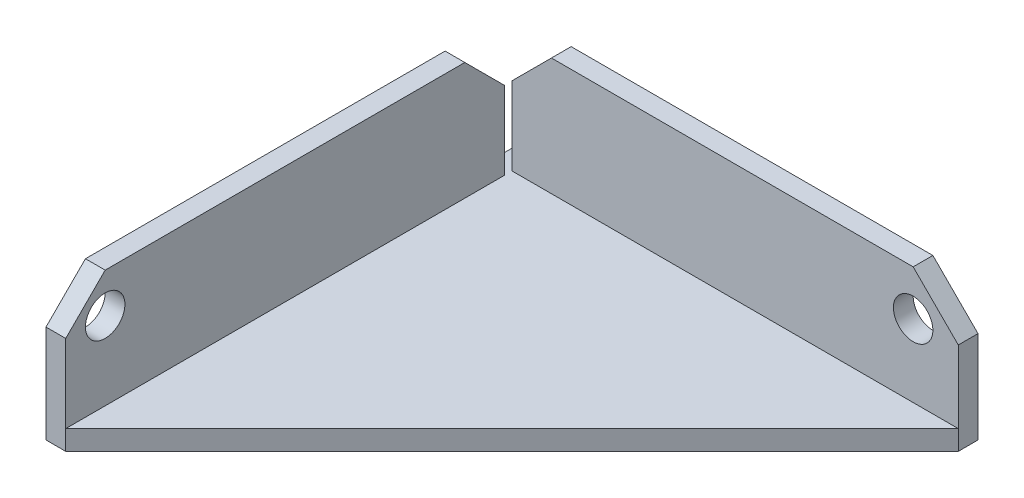
from build123d import *

# Parameters (mm, degrees)
BOSS_EXTRUDE1_DEPTH = 3.175
SKETCH2_W           = 71.842048969
SKETCH2_H           = 3.175
BOSS_EXTRUDE2_DEPTH = 18.923
SKETCH3_W           = 3.175
SKETCH3_H           = 70.598963312
BOSS_EXTRUDE6_DEPTH = 18.923
CUT_EXTRUDE1_DEPTH  = 18.923
CUT_EXTRUDE2_DEPTH  = 18.923
SKETCH7_R           = 3.175
CUT_EXTRUDE3_DEPTH  = 18.923
SKETCH6_R           = 3.175
CUT_EXTRUDE4_DEPTH  = 18.923


with BuildPart() as part:
    # Sketch1 → Boss-Extrude1 (new body)
    with BuildSketch(Plane(origin=(0, 0, 0), x_dir=(1, 0, 0), z_dir=(0, 1, 0))):
        Polygon((-16.345355317, 62.119418011), (58.671693652, 62.119418011), (58.671693652, 58.944418011), (-13.170355317, -12.897630958), (-16.345355317, -12.897630958), align=None)
    extrude(amount=BOSS_EXTRUDE1_DEPTH)

    # Sketch2 → Boss-Extrude2 (add)
    with BuildSketch(Plane(origin=(0, 3.175, 0), x_dir=(1, 0, 0), z_dir=(0, 1, 0))):
        with Locations((22.750669167, 60.531918011)):
            Rectangle(SKETCH2_W, SKETCH2_H)
    extrude(amount=BOSS_EXTRUDE2_DEPTH)

    # Sketch3 → Boss-Extrude6 (add)
    with BuildSketch(Plane(origin=(0, 3.175, 0), x_dir=(1, 0, 0), z_dir=(0, 1, 0))):
        with Locations((-14.757855317, 22.401850698)):
            Rectangle(SKETCH3_W, SKETCH3_H)
    extrude(amount=BOSS_EXTRUDE6_DEPTH)

    # Sketch4 → Cut-Extrude1 (cut)
    with BuildSketch(Plane.ZY.offset(16.345355317)):
        Polygon((6.547630958, 22.098), (12.897630958, 15.748), (12.897630958, 22.098), align=None)
        Polygon((-57.701332354, 22.098), (-57.701332354, 15.748), (-51.351332354, 22.098), align=None)
    extrude(amount=-CUT_EXTRUDE1_DEPTH, mode=Mode.SUBTRACT)

    # Sketch5 → Cut-Extrude2 (cut)
    with BuildSketch(Plane(origin=(0, 0, -62.119418011), x_dir=(-1, 0, 0), z_dir=(0, 0, -1))):
        Polygon((13.170355317, 15.748), (6.820355317, 22.098), (13.170355317, 22.098), align=None)
        Polygon((-58.671693652, 14.834935127), (-51.408628779, 22.098), (-58.671693652, 22.098), align=None)
    extrude(amount=-CUT_EXTRUDE2_DEPTH, mode=Mode.SUBTRACT)

    # Sketch7 → Cut-Extrude3 (cut)
    with BuildSketch(Plane(origin=(-13.170355317, 0, 0), x_dir=(0, 0, -1), z_dir=(1, 0, 0))):
        with Locations((-6.547630958, 15.748)):
            Circle(SKETCH7_R)
    extrude(amount=-CUT_EXTRUDE3_DEPTH, mode=Mode.SUBTRACT)

    # Sketch6 → Cut-Extrude4 (cut)
    with BuildSketch(Plane.XY.offset(-58.944418011)):
        with Locations((51.408628779, 14.834935127)):
            Circle(SKETCH6_R)
    extrude(amount=-CUT_EXTRUDE4_DEPTH, mode=Mode.SUBTRACT)


solid = part.part
